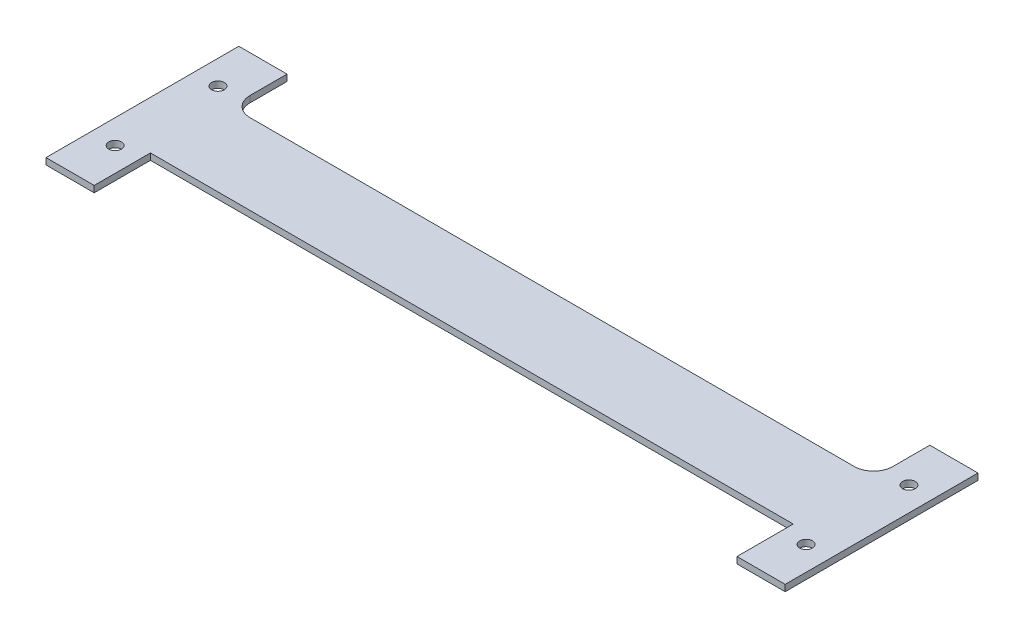
from build123d import *

# Parameters (mm, degrees)
SKETCH1_R           = 2.5
BOSS_EXTRUDE1_DEPTH = 2.54


with BuildPart() as part:
    # Sketch1 → Boss-Extrude1 (new body)
    with BuildSketch(Plane(origin=(0, 0, 0), x_dir=(1, 0, 0), z_dir=(0, 1, 0))):
        with BuildLine():
            Line((-127, 38.1), (-127, 23.495))
            ThreePointArc((-127, 23.495), (-124.768153673, 18.106846327), (-119.38, 15.875))
            Line((-119.38, 15.875), (119.38, 15.875))
            ThreePointArc((119.38, 15.875), (124.768153673, 18.106846327), (127, 23.495))
            Line((127, 23.495), (127, 38.1))
            Line((127, 38.1), (146.05, 38.1))
            Line((146.05, 38.1), (146.05, -38.1))
            Line((146.05, -38.1), (127, -38.1))
            Line((127, -38.1), (127, -15.875))
            Line((127, -15.875), (-127, -15.875))
            Line((-127, -15.875), (-127, -38.1))
            Line((-127, -38.1), (-146.05, -38.1))
            Line((-146.05, -38.1), (-146.05, 38.1))
            Line((-146.05, 38.1), (-127, 38.1))
        make_face()
        with Locations(Location((136.525, 20.32, 0), (0, 0, 270))):
            Circle(SKETCH1_R, mode=Mode.SUBTRACT)
        with Locations(Location((136.525, -20.32, 0), (0, 0, 270))):
            Circle(SKETCH1_R, mode=Mode.SUBTRACT)
        with Locations(Location((-136.525, 20.32, 0), (0, 0, 90))):
            Circle(SKETCH1_R, mode=Mode.SUBTRACT)
        with Locations(Location((-136.525, -20.32, 0), (0, 0, 90))):
            Circle(SKETCH1_R, mode=Mode.SUBTRACT)
    extrude(amount=BOSS_EXTRUDE1_DEPTH)


solid = part.part
